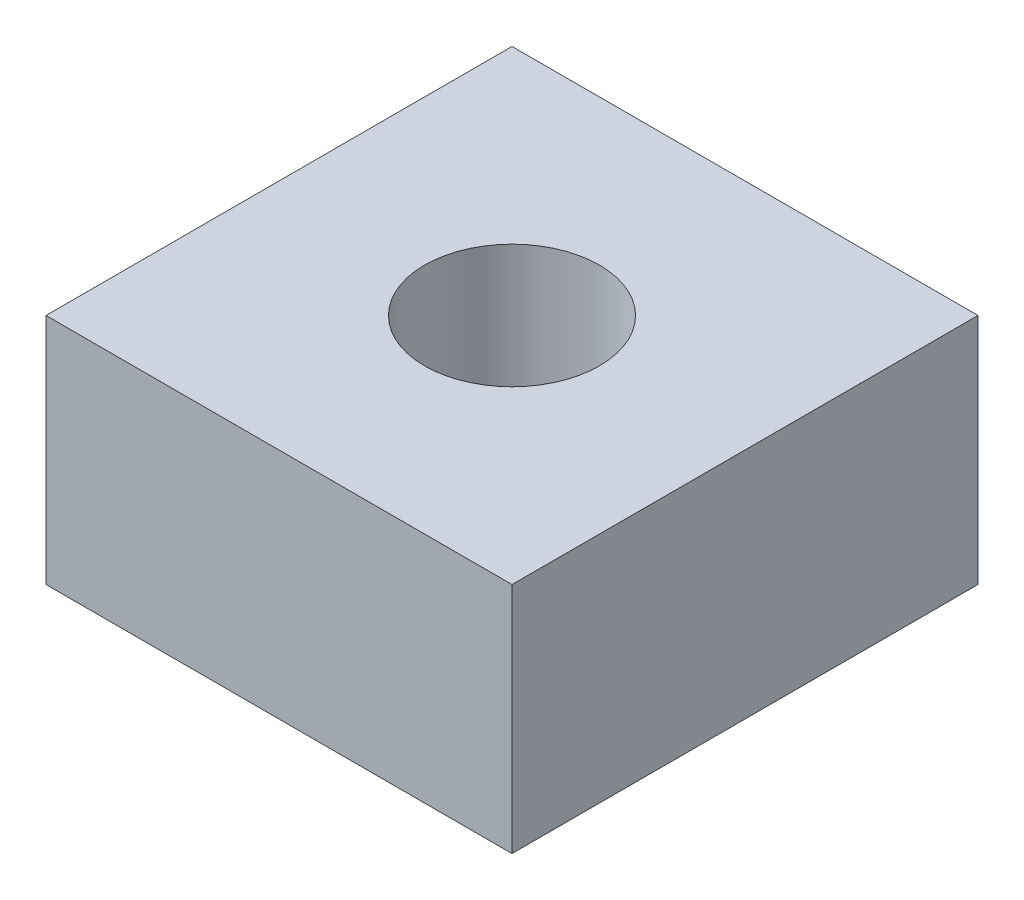
from build123d import *

# Parameters (mm, degrees)
SKETCH1_W           = 25.4
SKETCH1_H           = 25.4
SKETCH1_R           = 4.7625
BOSS_EXTRUDE1_DEPTH = 12.7


with BuildPart() as part:
    # Sketch1 → Boss-Extrude1 (new body)
    with BuildSketch(Plane(origin=(0, 0, 0), x_dir=(1, 0, 0), z_dir=(0, 1, 0))):
        Rectangle(SKETCH1_W, SKETCH1_H)
        with Locations(Location((0, 0, 0), (0, 0, 270))):
            Circle(SKETCH1_R, mode=Mode.SUBTRACT)
    extrude(amount=BOSS_EXTRUDE1_DEPTH)


solid = part.part
